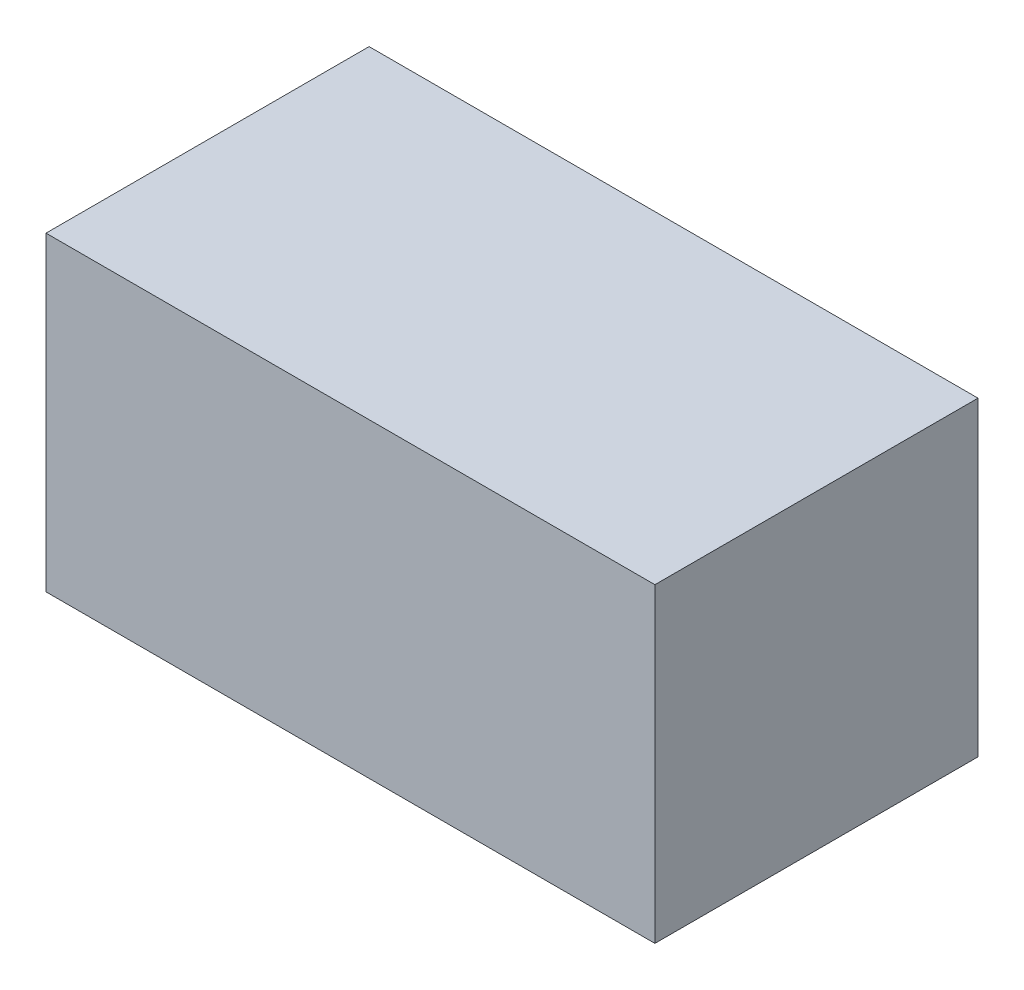
from build123d import *

# Parameters (mm, degrees)
SKETCH1_W           = 49
SKETCH1_H           = 25
BOSS_EXTRUDE1_DEPTH = 26


with BuildPart() as part:
    # Sketch1 → Boss-Extrude1 (new body)
    with BuildSketch(Plane.XY):
        Rectangle(SKETCH1_W, SKETCH1_H)
    extrude(amount=BOSS_EXTRUDE1_DEPTH)


solid = part.part
